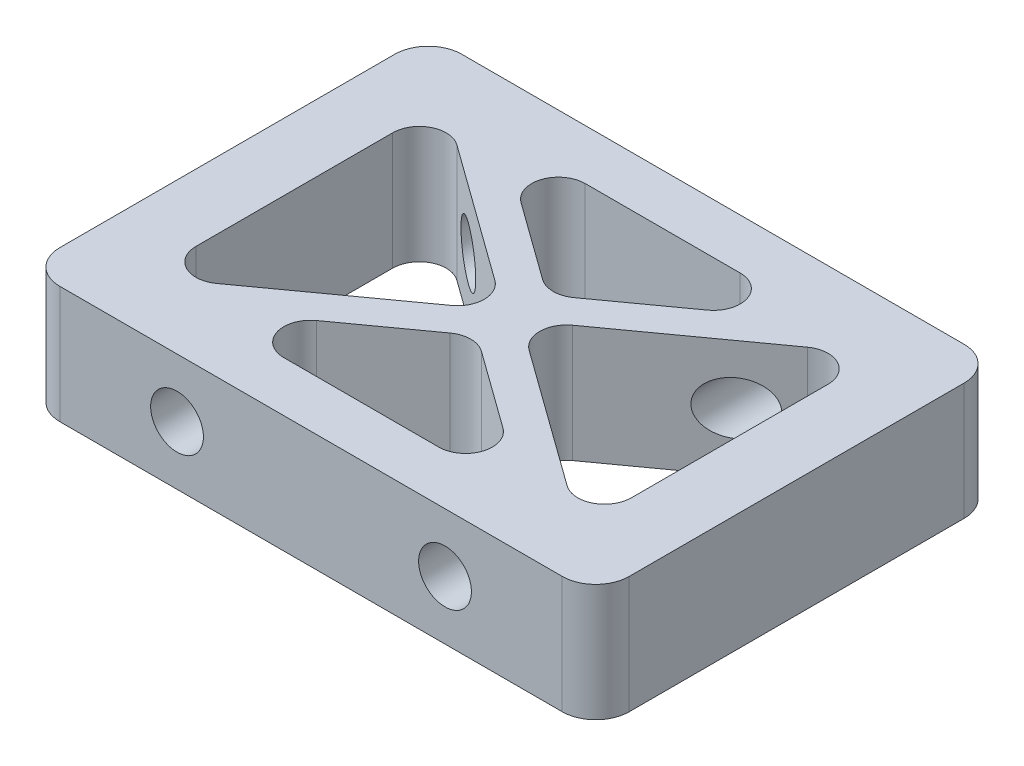
from build123d import *

# Parameters (mm, degrees)
SKETCH1_W           = 53.975
SKETCH1_H           = 11.1125
BOSS_EXTRUDE1_DEPTH = 38.1
FILLET1_R           = 3.175
CUT_EXTRUDE1_DEPTH  = 67.995509411
SKETCH3_R           = 2.5019
CUT_EXTRUDE2_DEPTH  = 38.1


with BuildPart() as part:
    # Sketch1 → Boss-Extrude1 (new body)
    with BuildSketch(Plane.XY):
        with Locations((26.9875, -5.55625)):
            Rectangle(SKETCH1_W, SKETCH1_H)
    extrude(amount=BOSS_EXTRUDE1_DEPTH)

    # Fillet1
    fillet1_edges = [part.edges().sort_by_distance(p)[0] for p in [
        (0, -5.55625, 38.1),
        (0, -5.55625, 0),
        (53.975, -5.55625, 0),
        (53.975, -5.55625, 38.1),
    ]]
    fillet(fillet1_edges, radius=FILLET1_R)

    # Sketch2 → Cut-Extrude1 (cut, through all)
    with BuildSketch(Plane(origin=(0, 0, 0), x_dir=(1, 0, 0), z_dir=(0, 1, 0))):
        with BuildLine():
            Line((6.35, -9.726273849), (6.35, -28.373726151))
            ThreePointArc((6.35, -28.373726151), (7.732948935, -30.63488356), (10.375852624, -30.433784883))
            Line((10.375852624, -30.433784883), (23.302722469, -21.110058732))
            ThreePointArc((23.302722469, -21.110058732), (24.356869845, -19.05), (23.302722469, -16.989941268))
            Line((23.302722469, -16.989941268), (10.375852624, -7.666215117))
            ThreePointArc((10.375852624, -7.666215117), (7.732948935, -7.46511644), (6.35, -9.726273849))
        make_face()
        with BuildLine():
            Line((18.155269838, -9.362558732), (25.501647376, -14.661259283))
            ThreePointArc((25.501647376, -14.661259283), (26.9875, -15.141200551), (28.473352624, -14.661259283))
            Line((28.473352624, -14.661259283), (35.819730162, -9.362558732))
            ThreePointArc((35.819730162, -9.362558732), (36.750915931, -6.521778917), (34.333877539, -4.7625))
            Line((34.333877539, -4.7625), (19.641122461, -4.7625))
            ThreePointArc((19.641122461, -4.7625), (17.224084069, -6.521778917), (18.155269838, -9.362558732))
        make_face()
        with BuildLine():
            Line((18.155269838, -28.737441268), (25.501647376, -23.438740717))
            ThreePointArc((25.501647376, -23.438740717), (26.9875, -22.958799449), (28.473352624, -23.438740717))
            Line((28.473352624, -23.438740717), (35.819730162, -28.737441268))
            ThreePointArc((35.819730162, -28.737441268), (36.750915931, -31.578221083), (34.333877539, -33.3375))
            Line((34.333877539, -33.3375), (19.641122461, -33.3375))
            ThreePointArc((19.641122461, -33.3375), (17.224084069, -31.578221083), (18.155269838, -28.737441268))
        make_face()
        with BuildLine():
            Line((47.625, -9.726273849), (47.625, -28.373726151))
            ThreePointArc((47.625, -28.373726151), (46.242051065, -30.63488356), (43.599147376, -30.433784883))
            Line((43.599147376, -30.433784883), (30.672277531, -21.110058732))
            ThreePointArc((30.672277531, -21.110058732), (29.618130155, -19.05), (30.672277531, -16.989941268))
            Line((30.672277531, -16.989941268), (43.599147376, -7.666215117))
            ThreePointArc((43.599147376, -7.666215117), (46.242051065, -7.46511644), (47.625, -9.726273849))
        make_face()
    extrude(amount=-CUT_EXTRUDE1_DEPTH, mode=Mode.SUBTRACT)

    # Sketch3 → Cut-Extrude2 (cut)
    with BuildSketch(Plane.XY.offset(38.1)):
        with Locations((14.2875, -5.55625)):
            Circle(SKETCH3_R)
        with Locations((39.6875, -5.55625)):
            Circle(SKETCH3_R)
    extrude(amount=-CUT_EXTRUDE2_DEPTH, mode=Mode.SUBTRACT)


solid = part.part
